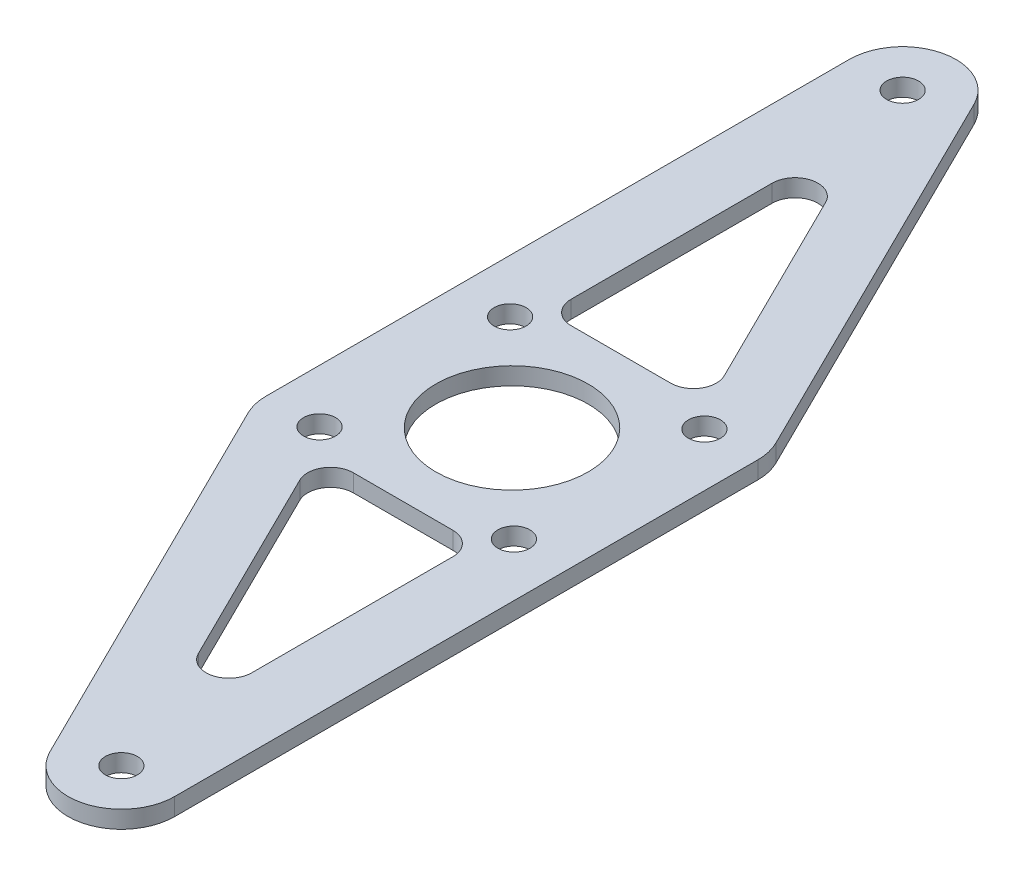
from build123d import *

# Parameters (mm, degrees)
SKETCH1_R           = 2.1
SKETCH1_R_2         = 10
BOSS_EXTRUDE1_DEPTH = 2.286


with BuildPart() as part:
    # Sketch1 → Boss-Extrude1 (new body)
    with BuildSketch(Plane(origin=(0, 0, 0), x_dir=(1, 0, 0), z_dir=(0, 1, 0))):
        with BuildLine():
            Line((6.476876236, -67.106109825), (-19.023123764, -15.606109825))
            ThreePointArc((-19.023123764, -15.606109825), (-19.565858946, -14.095013112), (-19.75, -12.5))
            Line((-19.75, -12.5), (-19.75, 64))
            ThreePointArc((-19.75, 64), (-14.345013112, 70.815858946), (-6.476876236, 67.106109825))
            Line((-6.476876236, 67.106109825), (19.023123764, 15.606109825))
            ThreePointArc((19.023123764, 15.606109825), (19.565858946, 14.095013112), (19.75, 12.5))
            Line((19.75, 12.5), (19.75, -64))
            ThreePointArc((19.75, -64), (14.345013112, -70.815858946), (6.476876236, -67.106109825))
        make_face()
        with Locations((-12.75, 64)):
            Circle(SKETCH1_R, mode=Mode.SUBTRACT)
        with Locations((-12.75, 12.5)):
            Circle(SKETCH1_R, mode=Mode.SUBTRACT)
        with Locations((12.75, 12.5)):
            Circle(SKETCH1_R, mode=Mode.SUBTRACT)
        with Locations((12.75, -12.5)):
            Circle(SKETCH1_R, mode=Mode.SUBTRACT)
        with Locations((12.75, -64)):
            Circle(SKETCH1_R, mode=Mode.SUBTRACT)
        with Locations((-12.75, -12.5)):
            Circle(SKETCH1_R, mode=Mode.SUBTRACT)
        Circle(SKETCH1_R_2, mode=Mode.SUBTRACT)
        with BuildLine():
            Line((-5.061518387, 46.218659407), (8.004121842, 19.831189925))
            ThreePointArc((8.004121842, 19.831189925), (7.864519372, 16.917844789), (5.315640229, 15.5))
            Line((5.315640229, 15.5), (-7.75, 15.5))
            ThreePointArc((-7.75, 15.5), (-9.871320344, 16.378679656), (-10.75, 18.5))
            Line((-10.75, 18.5), (-10.75, 44.887469482))
            ThreePointArc((-10.75, 44.887469482), (-8.433577048, 47.808551887), (-5.061518387, 46.218659407))
        make_face(mode=Mode.SUBTRACT)
        with BuildLine():
            Line((5.061518387, -46.218659407), (-8.004121842, -19.831189925))
            ThreePointArc((-8.004121842, -19.831189925), (-7.864519372, -16.917844789), (-5.315640229, -15.5))
            Line((-5.315640229, -15.5), (7.75, -15.5))
            ThreePointArc((7.75, -15.5), (9.871320344, -16.378679656), (10.75, -18.5))
            Line((10.75, -18.5), (10.75, -44.887469482))
            ThreePointArc((10.75, -44.887469482), (8.433577048, -47.808551887), (5.061518387, -46.218659407))
        make_face(mode=Mode.SUBTRACT)
    extrude(amount=-BOSS_EXTRUDE1_DEPTH)


solid = part.part
